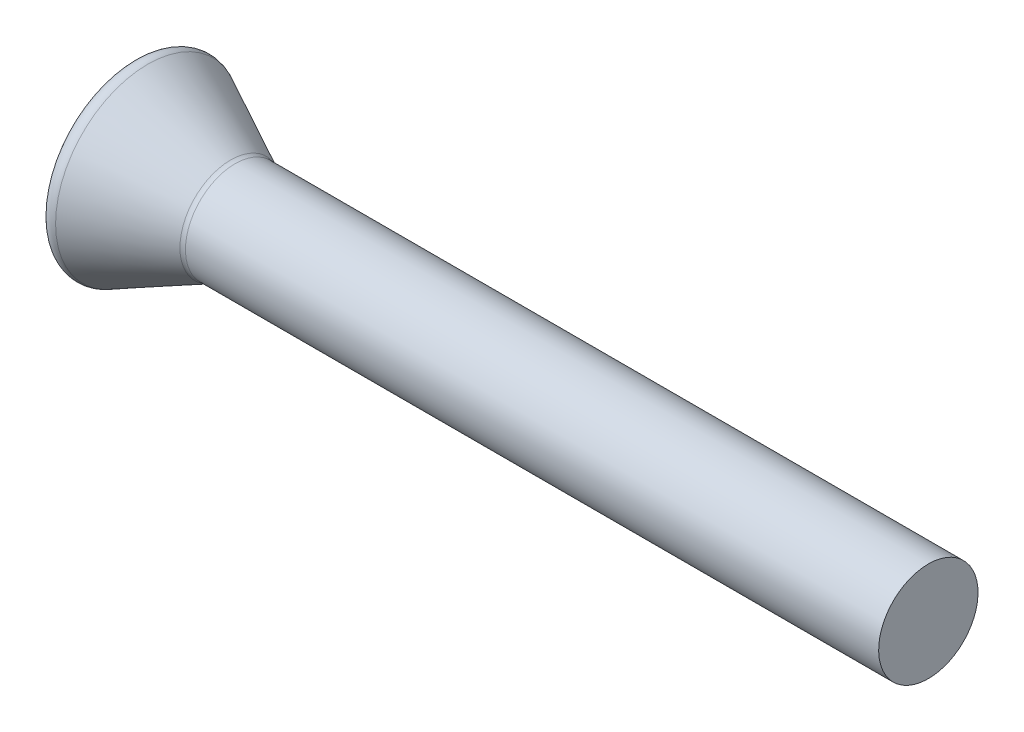
from build123d import *

# Parameters (mm, degrees)
FILLET_1_R = 0.1


with BuildPart() as part:
    # 草图1 → 旋转1 (revolve)
    with BuildSketch(Plane.XY):
        Polygon((0, 0), (0, 1), (1, 0.5), (8, 0.5), (8, 0), align=None)
    revolve(axis=Axis((8, 0, 0), (-1, 0, 0)))

    # 圆角1
    fillet_1_edges = [part.edges().sort_by_distance(p)[0] for p in [
        (1, -0.5, 0),
        (0, -1, 0),
    ]]
    fillet(fillet_1_edges, radius=FILLET_1_R)


solid = part.part
